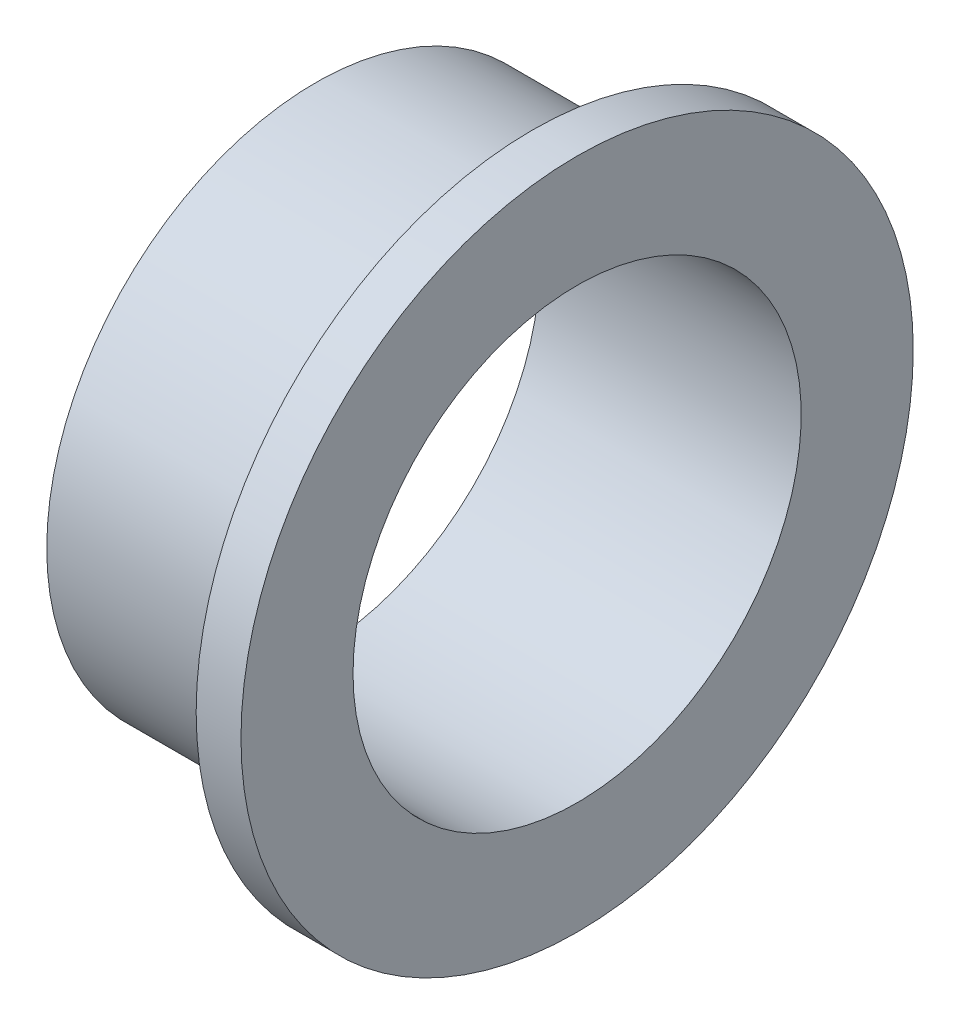
from build123d import *


with BuildPart() as part:
    # Sketch1 → Revolve1 (revolve)
    with BuildSketch(Plane.XY, mode=Mode.PRIVATE) as revolve1_sk:
        Polygon((-35, 30), (0, 30), (0, 45), (-6, 45), (-6, 36), (-35, 36), align=None)
    revolve(revolve1_sk.sketch.rotate(Axis((-57.123287671, 0, 0), (1, 0, 0)), 90), axis=Axis((-57.123287671, 0, 0), (1, 0, 0)))


solid = part.part
